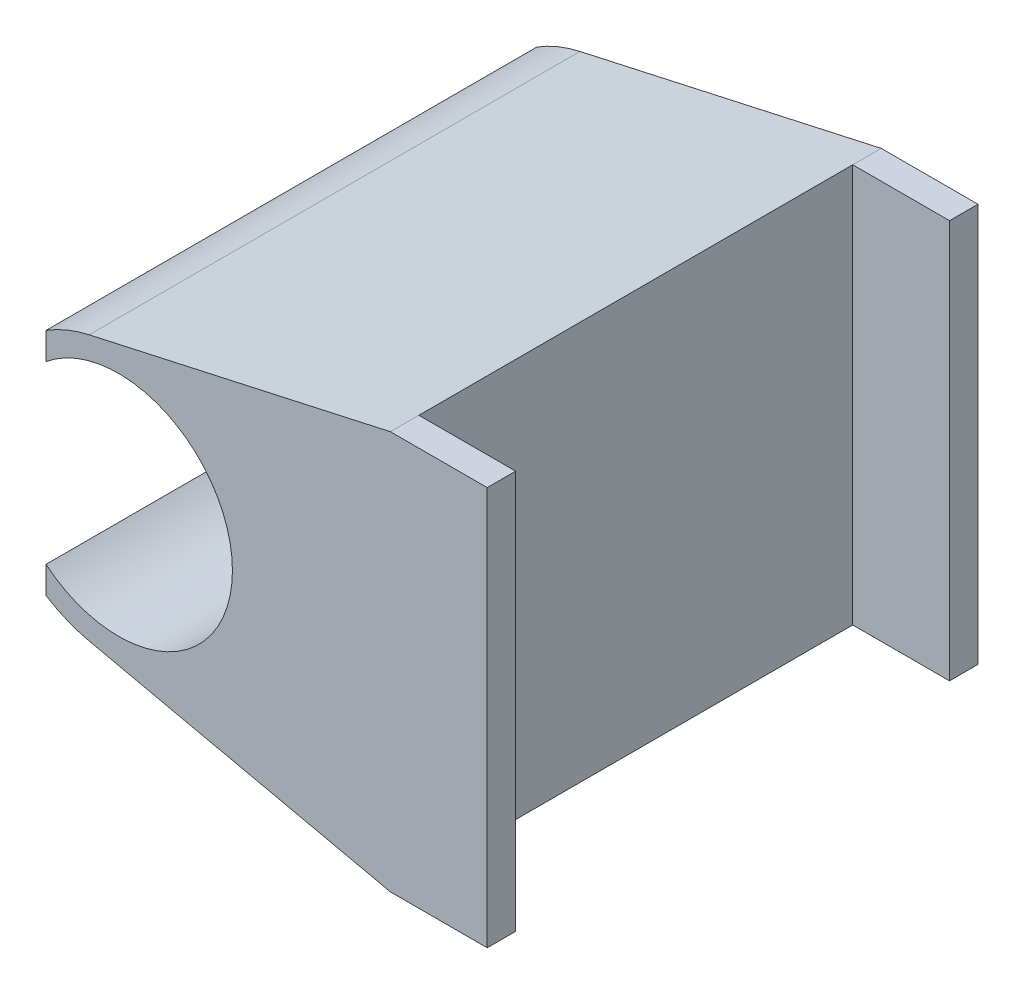
from build123d import *

# Parameters (mm, degrees)
BOSS_EXTRUDE1_DEPTH = 35
CUT_EXTRUDE1_DEPTH  = 70.844474549


with BuildPart() as part:
    # Sketch1 → Boss-Extrude1 (new body)
    with BuildSketch(Plane(origin=(0, 0, 0), x_dir=(1, 0, 0), z_dir=(0, 1, 0))):
        Polygon((0, 26.77195122), (0, 29.27195122), (-42.375, 29.27195122), (-42.375, -13.82804878), (0, -13.82804878), (0, -11.32804878), (-8.5, -11.32804878), (-8.5, 26.77195122), align=None)
    extrude(amount=BOSS_EXTRUDE1_DEPTH)

    # Sketch2 → Cut-Extrude1 (cut, through all)
    with BuildSketch(Plane.XY.offset(13.82804878)):
        Polygon((-34.952848492, 5.856719223), (-38.746244971, 6.696585602), (-42.375, 6.696585602), (-42.375, 0), (-8.5, 0), align=None)
        Polygon((-38.746244971, 6.696585602), (-42.375, 7.5), (-42.375, 6.696585602), align=None)
        with BuildLine():
            Line((-42.375, 11.002978368), (-42.375, 7.5))
            Line((-42.375, 7.5), (-38.746244971, 6.696585602))
            Line((-38.746244971, 6.696585602), (-38.746244971, 7.41939845))
            ThreePointArc((-38.746244971, 7.41939845), (-40.75443475, 9.014932919), (-42.375, 11.002978368))
        make_face()
        with BuildLine():
            Line((-38.746244971, 7.41939845), (-38.746244971, 6.696585602))
            Line((-38.746244971, 6.696585602), (-34.952848492, 5.856719223))
            ThreePointArc((-34.952848492, 5.856719223), (-36.91725275, 6.473702795), (-38.746244971, 7.41939845))
        make_face()
        Polygon((-38.746244971, 28.303414398), (-34.952847988, 29.143280888), (-8.5, 35), (-42.375, 35), (-42.375, 28.303414398), align=None)
        with BuildLine():
            Line((-38.746244971, 28.303414398), (-38.746244971, 27.58060155))
            ThreePointArc((-38.746244971, 27.58060155), (-36.917252511, 28.526297303), (-34.952847988, 29.143280888))
            Line((-34.952847988, 29.143280888), (-38.746244971, 28.303414398))
        make_face()
        Polygon((-42.375, 28.303414398), (-42.375, 27.5), (-38.746244971, 28.303414398), align=None)
        with BuildLine():
            Line((-42.375, 27.5), (-42.375, 23.997021632))
            ThreePointArc((-42.375, 23.997021632), (-40.75443475, 25.985067081), (-38.746244971, 27.58060155))
            Line((-38.746244971, 27.58060155), (-38.746244971, 28.303414398))
            Line((-38.746244971, 28.303414398), (-42.375, 27.5))
        make_face()
        with BuildLine():
            ThreePointArc((-38.746244971, 25.207609066), (-41.422443001, 21.75955105), (-42.375, 17.5))
            ThreePointArc((-42.375, 17.5), (-41.422443001, 13.24044895), (-38.746244971, 9.792390934))
            Line((-38.746244971, 9.792390934), (-38.746244971, 25.207609066))
        make_face()
        with BuildLine():
            Line((-38.746244971, 25.207609066), (-38.746244971, 9.792390934))
            ThreePointArc((-38.746244971, 9.792390934), (-28.11544895, 8.452556999), (-22.375, 17.5))
            ThreePointArc((-22.375, 17.5), (-28.11544895, 26.547443001), (-38.746244971, 25.207609066))
        make_face()
        with BuildLine():
            Line((-42.375, 17.5), (-42.375, 11.002978368))
            ThreePointArc((-42.375, 11.002978368), (-40.75443475, 9.014932919), (-38.746244971, 7.41939845))
            Line((-38.746244971, 7.41939845), (-38.746244971, 9.792390934))
            ThreePointArc((-38.746244971, 9.792390934), (-41.422443001, 13.24044895), (-42.375, 17.5))
        make_face()
        with BuildLine():
            Line((-42.375, 23.997021632), (-42.375, 17.5))
            ThreePointArc((-42.375, 17.5), (-41.422443001, 21.75955105), (-38.746244971, 25.207609066))
            Line((-38.746244971, 25.207609066), (-38.746244971, 27.58060155))
            ThreePointArc((-38.746244971, 27.58060155), (-40.75443475, 25.985067081), (-42.375, 23.997021632))
        make_face()
    extrude(amount=-CUT_EXTRUDE1_DEPTH, mode=Mode.SUBTRACT)


solid = part.part
